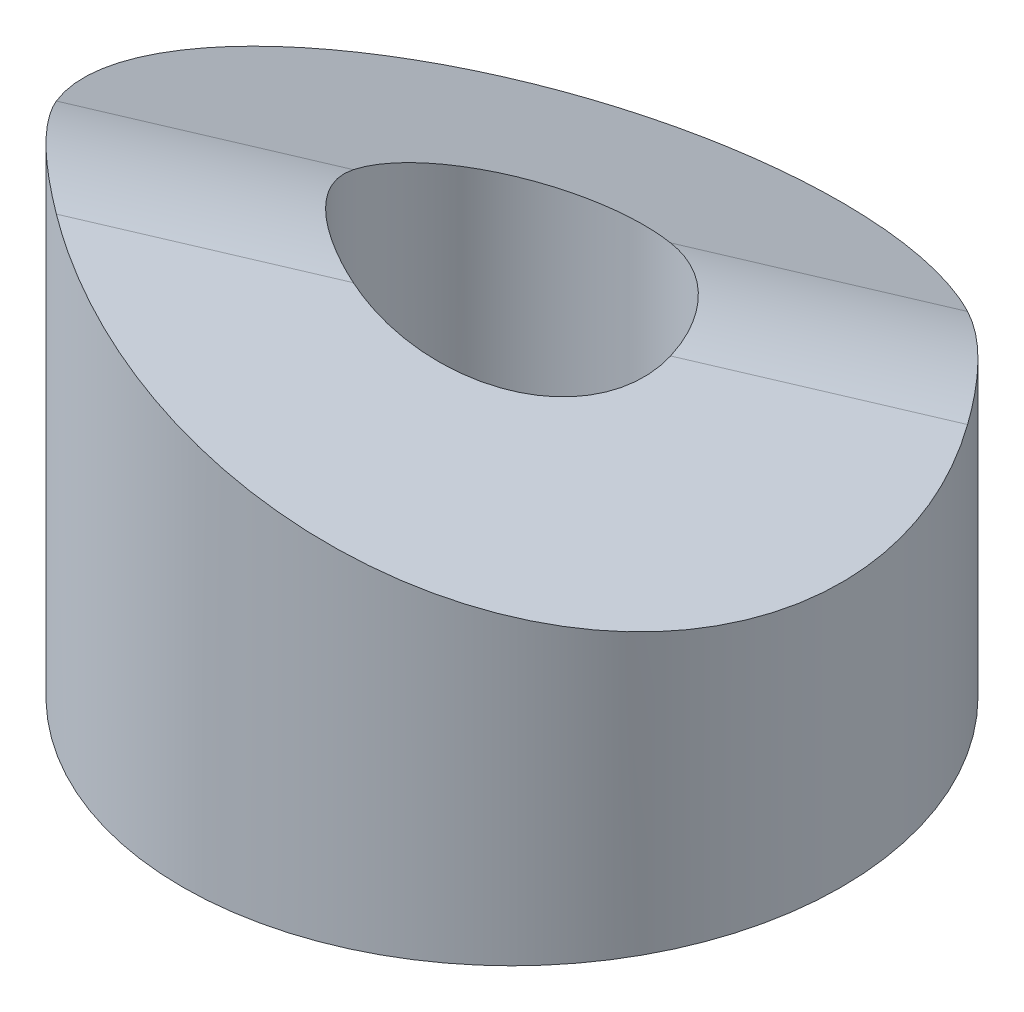
from build123d import *

# Parameters (mm, degrees)
SKETCH1_R               = 7.9375
SKETCH1_R_2             = 3.175
BOSS_EXTRUDE1_DEPTH     = 12.7
CUT_EXTRUDE1_DEPTH      = 17.949861725
CUT_EXTRUDE1_DEPTH_BACK = 17.949861725
CUT_EXTRUDE3_DEPTH      = 17.949861725
CUT_EXTRUDE3_DEPTH_BACK = 17.949861725
FILLET1_R               = 6.35


with BuildPart() as part:
    # Sketch1 → Boss-Extrude1 (new body)
    with BuildSketch(Plane(origin=(0, 0, 0), x_dir=(1, 0, 0), z_dir=(0, 1, 0))):
        with Locations(Location((0, 0, 0), (0, 0, 270))):
            Circle(SKETCH1_R)
        with Locations(Location((0, 0, 0), (0, 0, 270))):
            Circle(SKETCH1_R_2, mode=Mode.SUBTRACT)
    extrude(amount=BOSS_EXTRUDE1_DEPTH)

    # Sketch2 → Cut-Extrude1 (cut, two sides: drawn at the far end of the back side and taken through both)
    with BuildSketch(Plane(origin=(0, 0, 0), x_dir=(0, 0, -1), z_dir=(1, 0, 0)).offset(-CUT_EXTRUDE1_DEPTH_BACK)):
        Polygon((7.9375, 12.7), (-7.9375, 12.7), (7.9375, 6.35), align=None)
    extrude(amount=CUT_EXTRUDE1_DEPTH + CUT_EXTRUDE1_DEPTH_BACK, mode=Mode.SUBTRACT)

    # Sketch3 → Cut-Extrude3 (cut, two sides: drawn at the far end of the back side and taken through both)
    with BuildSketch(Plane.XY.offset(-CUT_EXTRUDE3_DEPTH_BACK)):
        Polygon((7.9375, 12.7), (-7.9375, 12.7), (7.9375, 6.35), align=None)
    extrude(amount=CUT_EXTRUDE3_DEPTH + CUT_EXTRUDE3_DEPTH_BACK, mode=Mode.SUBTRACT)

    # Fillet1
    fillet1_edges = [part.edges().sort_by_distance(p)[0] for p in [
        (-3.928862053, 11.096544821, 3.928862053),
        (3.928862053, 7.953455179, -3.928862053),
    ]]
    fillet(fillet1_edges, radius=FILLET1_R)


solid = part.part
